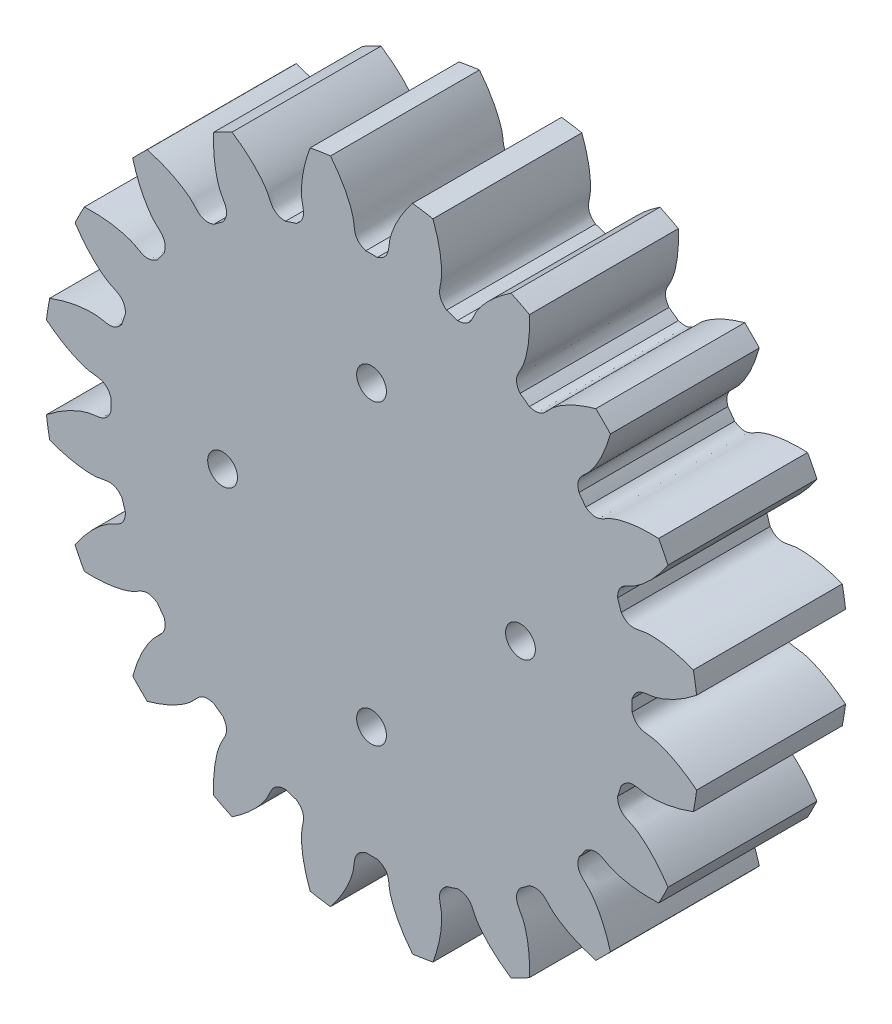
from build123d import *

# Parameters (mm, degrees)
SKETCH_1_R               = 66
EXTRUDE_1_DEPTH          = 30
CUT_EXTRUDE_1_DEPTH      = 99.04080783
PATTERN_CIRCULAR_1_COUNT = 20
SKETCH_4_R               = 3
CUT_EXTRUDE_3_DEPTH      = 100
SKETCH_5_R               = 41.949497996
EXTRUDE_3_DEPTH          = 30
SKETCH_6_R               = 3
CUT_EXTRUDE_4_DEPTH      = 30


with BuildPart() as part:
    # 草图1 → 凸台-拉伸1 (new body)
    with BuildSketch(Plane.XY):
        Circle(SKETCH_1_R)
    extrude(amount=EXTRUDE_1_DEPTH)

    # 草图2 → 切除-拉伸1 (cut, through all)
    with BuildSketch(Plane.XY):
        with BuildLine():
            ThreePointArc((1.159899603, 52.487185416), (0, 52.5), (-1.159899603, 52.487185416))
            add(Edge.make_bspline(
                [(-1.159899603, 52.487185416), (-3.667136429, 53.360853072), (-3.342504596, 55.122682193), (-3.677382338, 56.820056415), (-3.713353118, 56.985339684), (-3.757865339, 57.171807691), (-3.811752582, 57.379181016), (-3.875874841, 57.607148981), (-3.95107233, 57.855376968), (-4.038179229, 58.123504398), (-4.138018499, 58.411145682), (-4.251402599, 58.717890271), (-4.379132391, 59.043303003), (-4.521996613, 59.386924384), (-4.680771188, 59.748270908), (-4.856218588, 60.126835389), (-5.049087201, 60.522087305), (-5.260110701, 60.933473168), (-5.49000743, 61.360416899), (-5.739479794, 61.802320224), (-6.009213656, 62.258563085), (-6.299877757, 62.728504067), (-6.612123129, 63.211480832), (-6.946582534, 63.706810582), (-7.303869906, 64.213790522), (-7.684579804, 64.731698343), (-8.089286883, 65.259792724), (-8.51854537, 65.797313836), (-8.972888558, 66.343483869), (-9.452828311, 66.897507567), (-9.958854579, 67.458572777), (-10.491434933, 68.02585101), (-11.051014106, 68.598498015), (-11.638013557, 69.175654361), (-12.252831039, 69.756446037), (-12.895840191, 70.339985054), (-13.567390137, 70.925370065), (-14.26780511, 71.511686996), (-14.99738407, 72.098009677), (-15.756400406, 72.68340049), (-16.545101397, 73.266911041), (-17.648841545, 74.049839206), (-18.503594475, 74.617995606), (-19.086947891, 74.989511158)],
                knots=[0, 0, 0, 0, 0.165916003, 0.170905922, 0.176663519, 0.183188797, 0.190481754, 0.198542391, 0.207370708, 0.216966704, 0.22733038, 0.238461736, 0.250360771, 0.263027487, 0.276461881, 0.290663956, 0.30563371, 0.321371144, 0.337876258, 0.355149051, 0.373189524, 0.391997677, 0.411573509, 0.431917021, 0.453028213, 0.474907084, 0.497553636, 0.520967867, 0.545149777, 0.570099367, 0.595816637, 0.622301587, 0.649554216, 0.677574526, 0.706362514, 0.735918183, 0.766241531, 0.797332559, 0.829191267, 0.861817654, 0.895211721, 0.929373468, 1, 1, 1, 1], degree=3))
            ThreePointArc((-19.086947891, 74.989511158), (0, 77.380477922), (19.086947891, 74.989511158))
            add(Edge.make_bspline(
                [(1.159899603, 52.487185416), (3.667136429, 53.360853072), (3.342504596, 55.122682193), (3.677382338, 56.820056415), (3.713353118, 56.985339684), (3.757865339, 57.171807691), (3.811752582, 57.379181016), (3.875874841, 57.607148981), (3.95107233, 57.855376968), (4.038179229, 58.123504398), (4.138018499, 58.411145682), (4.251402599, 58.717890271), (4.379132391, 59.043303003), (4.521996613, 59.386924384), (4.680771188, 59.748270908), (4.856218588, 60.126835389), (5.049087201, 60.522087305), (5.260110701, 60.933473168), (5.49000743, 61.360416899), (5.739479794, 61.802320224), (6.009213656, 62.258563085), (6.299877757, 62.728504067), (6.612123129, 63.211480832), (6.946582534, 63.706810582), (7.303869906, 64.213790522), (7.684579804, 64.731698343), (8.089286883, 65.259792724), (8.51854537, 65.797313836), (8.972888558, 66.343483869), (9.452828311, 66.897507567), (9.958854579, 67.458572777), (10.491434933, 68.02585101), (11.051014106, 68.598498015), (11.638013557, 69.175654361), (12.252831039, 69.756446037), (12.895840191, 70.339985054), (13.567390137, 70.925370065), (14.26780511, 71.511686996), (14.99738407, 72.098009677), (15.756400406, 72.68340049), (16.545101397, 73.266911041), (17.648841545, 74.049839206), (18.503594475, 74.617995606), (19.086947891, 74.989511158)],
                knots=[0, 0, 0, 0, 0.165916003, 0.170905922, 0.176663519, 0.183188797, 0.190481754, 0.198542391, 0.207370708, 0.216966704, 0.22733038, 0.238461736, 0.250360771, 0.263027487, 0.276461881, 0.290663956, 0.30563371, 0.321371144, 0.337876258, 0.355149051, 0.373189524, 0.391997677, 0.411573509, 0.431917021, 0.453028213, 0.474907084, 0.497553636, 0.520967867, 0.545149777, 0.570099367, 0.595816637, 0.622301587, 0.649554216, 0.677574526, 0.706362514, 0.735918183, 0.766241531, 0.797332559, 0.829191267, 0.861817654, 0.895211721, 0.929373468, 1, 1, 1, 1], degree=3))
        make_face()
    cut_extrude_1 = extrude(amount=CUT_EXTRUDE_1_DEPTH, mode=Mode.SUBTRACT)

    # 阵列(圆周)1: 切除-拉伸1 ×20 about axis
    pattern_circular_1_axis = Axis((0, 0, -1.5), (0, 0, 1))
    for i in range(1, PATTERN_CIRCULAR_1_COUNT):
        add(cut_extrude_1.rotate(pattern_circular_1_axis, i * 360 / PATTERN_CIRCULAR_1_COUNT), mode=Mode.SUBTRACT)

    # 草图4 → 切除-拉伸3 (cut)
    with BuildSketch(Plane.XY.offset(30)):
        with Locations((-35, 0)):
            Circle(SKETCH_4_R)
        with Locations((-17.5, 30.310889132)):
            Circle(SKETCH_4_R)
        with Locations((17.5, 30.310889132)):
            Circle(SKETCH_4_R)
        with Locations((35, 0)):
            Circle(SKETCH_4_R)
        with Locations((17.5, -30.310889132)):
            Circle(SKETCH_4_R)
        with Locations((-17.5, -30.310889132)):
            Circle(SKETCH_4_R)
    extrude(amount=-CUT_EXTRUDE_3_DEPTH, mode=Mode.SUBTRACT)

    # 草图5 → 凸台-拉伸3 (add)
    with BuildSketch(Plane.XY.offset(30)):
        Circle(SKETCH_5_R)
    extrude(amount=-EXTRUDE_3_DEPTH)

    # 草图6 → 切除-拉伸4 (cut)
    with BuildSketch(Plane.XY.offset(30)):
        with Locations((-30, 0)):
            Circle(SKETCH_6_R)
        with Locations((0, 30)):
            Circle(SKETCH_6_R)
        with Locations((30, 0)):
            Circle(SKETCH_6_R)
        with Locations((0, -30)):
            Circle(SKETCH_6_R)
    extrude(amount=-CUT_EXTRUDE_4_DEPTH, mode=Mode.SUBTRACT)


solid = part.part
